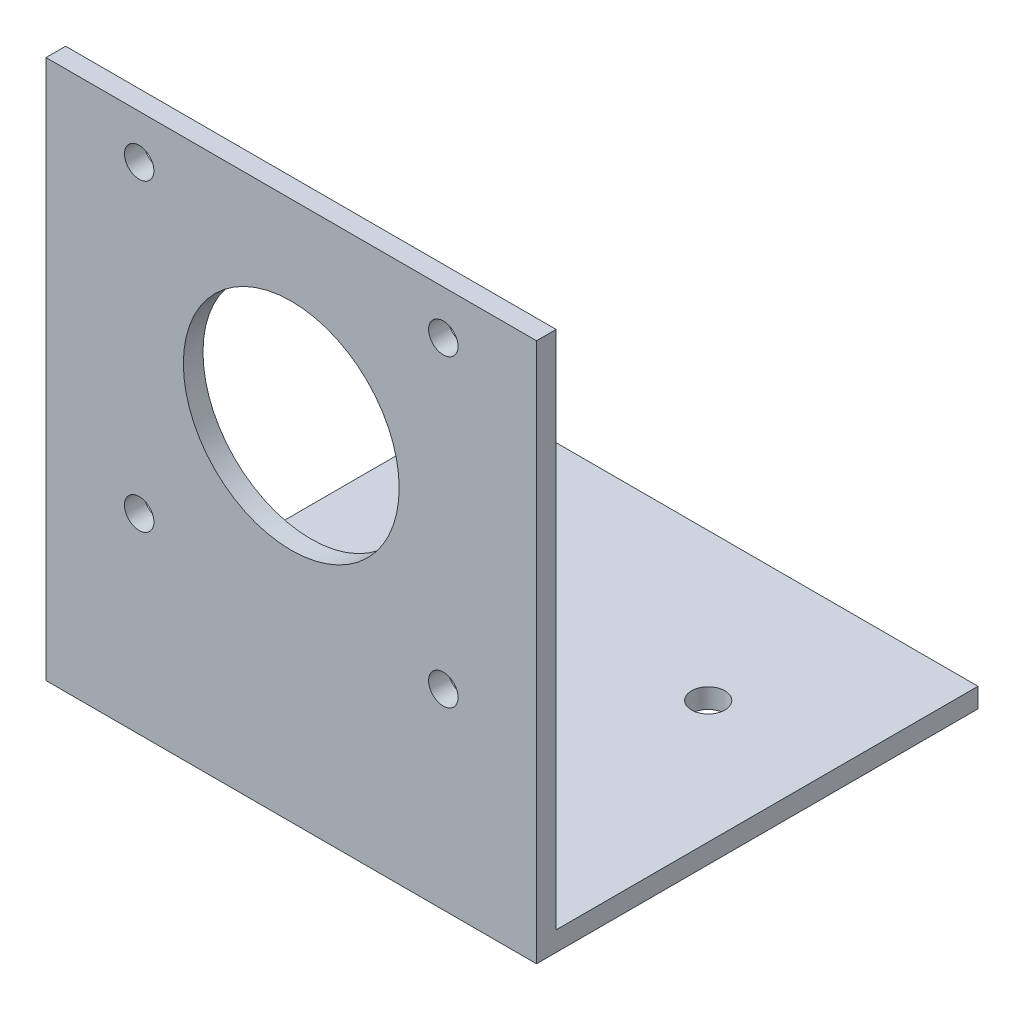
from build123d import *

# Parameters (mm, degrees)
SKETCH1_W                 = 50
SKETCH1_H                 = 55
BOSS_EXTRUDE1_DEPTH       = 2
SKETCH2_W                 = 50
SKETCH2_H                 = 2
BOSS_EXTRUDE2_DEPTH       = 45
CUT_EXTRUDE1_DEPTH        = 76.332595867
CUT_EXTRUDE1_DEPTH_BACK   = 76.332595867
SKETCH3_R                 = 1.5
LO_TAM_D22_DEPTH          = 76.332595867
LO_TAM_D22_DEPTH_BACK     = 76.332595867
SKETCH4_R                 = 11
HAI_LO_CHAN_M3_DEPTH      = 76.332595867
HAI_LO_CHAN_M3_DEPTH_BACK = 76.332595867
SKETCH5_R                 = 1.7


with BuildPart() as part:
    # Sketch1 → Boss-Extrude1 (new body)
    with BuildSketch(Plane.XY):
        with Locations((0, 27.5)):
            Rectangle(SKETCH1_W, SKETCH1_H)
    extrude(amount=-BOSS_EXTRUDE1_DEPTH)

    # Sketch2 → Boss-Extrude2 (add)
    with BuildSketch(Plane.XY):
        with Locations((0, 1)):
            Rectangle(SKETCH2_W, SKETCH2_H)
    extrude(amount=-BOSS_EXTRUDE2_DEPTH)

    # Sketch3 → Cut-Extrude1 (cut, two sides: drawn at the far end of the back side and taken through both)
    with BuildSketch(Plane.XY.offset(-CUT_EXTRUDE1_DEPTH_BACK)):
        with Locations(Location((-15.5, 19.5, 0), (0, 0, 180))):
            Circle(SKETCH3_R)
        with Locations(Location((-15.5, 50.5, 0), (0, 0, 180))):
            Circle(SKETCH3_R)
        with Locations(Location((15.5, 19.5, 0), (0, 0, 180))):
            Circle(SKETCH3_R)
        with Locations(Location((15.5, 50.5, 0), (0, 0, 180))):
            Circle(SKETCH3_R)
    extrude(amount=CUT_EXTRUDE1_DEPTH + CUT_EXTRUDE1_DEPTH_BACK, mode=Mode.SUBTRACT)

    # Sketch4 → Lo_tam_D22 (cut, two sides: drawn at the far end of the back side and taken through both)
    with BuildSketch(Plane.XY.offset(-LO_TAM_D22_DEPTH_BACK)):
        with Locations(Location((0, 35, 0), (0, 0, 180))):
            Circle(SKETCH4_R)
    extrude(amount=LO_TAM_D22_DEPTH + LO_TAM_D22_DEPTH_BACK, mode=Mode.SUBTRACT)

    # Sketch5 → Hai_lo_chan_M3 (cut, two sides: drawn at the far end of the back side and taken through both)
    with BuildSketch(Plane(origin=(0, 0, 0), x_dir=(1, 0, 0), z_dir=(0, 1, 0)).offset(-HAI_LO_CHAN_M3_DEPTH_BACK)):
        with Locations(Location((-12.5, 30, 0), (0, 0, 270))):
            Circle(SKETCH5_R)
        with Locations(Location((12.5, 30, 0), (0, 0, 270))):
            Circle(SKETCH5_R)
    extrude(amount=HAI_LO_CHAN_M3_DEPTH + HAI_LO_CHAN_M3_DEPTH_BACK, mode=Mode.SUBTRACT)


solid = part.part
